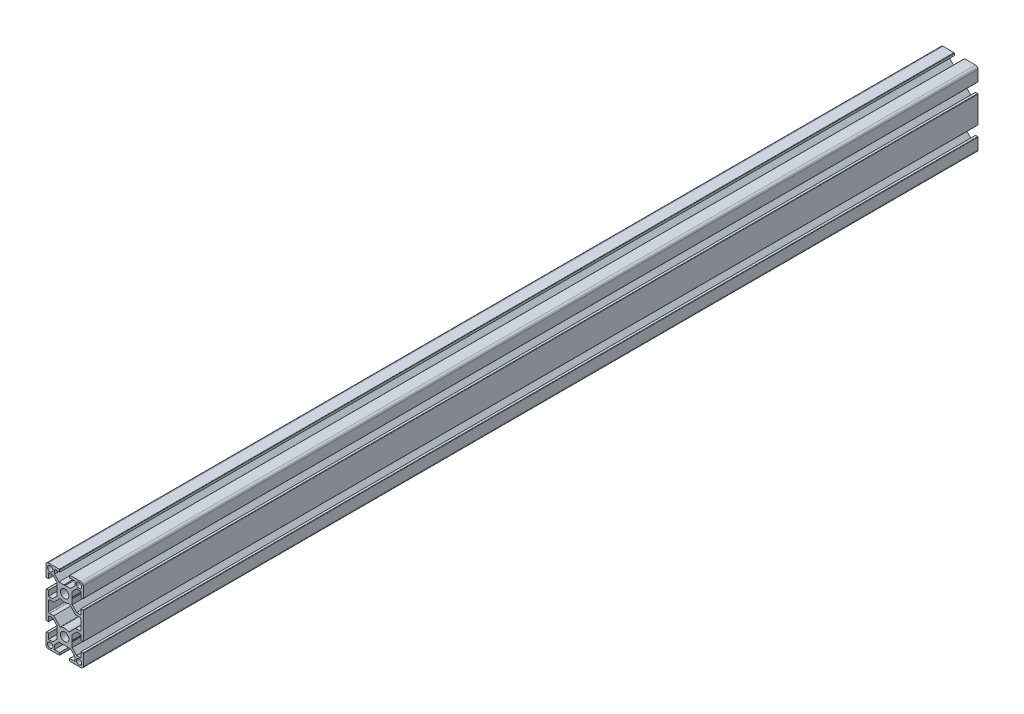
from build123d import *

# Parameters (mm, degrees)
SKETCH2_R           = 2.1
SKETCH2_R_2         = 3.4
BOSS_EXTRUDE1_DEPTH = 720


with BuildPart() as part:
    # Sketch2 → Boss-Extrude1 (new body)
    with BuildSketch(Plane.XY):
        with BuildLine():
            Line((-13, -30), (-4.3, -30))
            ThreePointArc((-4.3, -30), (-4.087867966, -29.912132034), (-4, -29.7))
            Line((-4, -29.7), (-4, -28))
            Line((-4, -28), (-8.249999995, -28))
            Line((-8.249999995, -28), (-8.249999995, -24.664213567))
            Line((-8.249999995, -24.664213567), (-4.585786428, -21))
            Line((-4.585786428, -21), (-0.519615237, -21))
            Line((-0.519615237, -21), (5e-09, -20.7))
            Line((5e-09, -20.7), (0.519615247, -21))
            Line((0.519615247, -21), (4.585786438, -21))
            Line((4.585786438, -21), (8.250000005, -24.664213567))
            Line((8.250000005, -24.664213567), (8.250000005, -28))
            Line((8.250000005, -28), (4, -28))
            Line((4, -28), (4, -29.7))
            ThreePointArc((4, -29.7), (4.087867966, -29.912132034), (4.3, -30))
            Line((4.3, -30), (13, -30))
            ThreePointArc((13, -30), (14.414213562, -29.414213562), (15, -28))
            Line((15, -28), (15, -19.3000023))
            ThreePointArc((15, -19.3000023), (14.912132034, -19.087870266), (14.7, -19.0000023))
            Line((14.7, -19.0000023), (13.000000005, -19.0000023))
            Line((13.000000005, -19.0000023), (13.000000005, -23.250000005))
            Line((13.000000005, -23.250000005), (9.664213567, -23.250000005))
            Line((9.664213567, -23.250000005), (6.000000005, -19.585786443))
            Line((6.000000005, -19.585786443), (6.000000005, -15.519615247))
            Line((6.000000005, -15.519615247), (5.700000005, -15.000000005))
            Line((5.700000005, -15.000000005), (6.000000005, -14.480384763))
            Line((6.000000005, -14.480384763), (6.000000005, -10.414213567))
            Line((6.000000005, -10.414213567), (9.664213567, -6.750000005))
            Line((9.664213567, -6.750000005), (13.000000005, -6.750000005))
            Line((13.000000005, -6.750000005), (13.000000005, -11.0000023))
            Line((13.000000005, -11.0000023), (14.7, -11.0000023))
            ThreePointArc((14.7, -11.0000023), (14.912132034, -10.912134335), (15, -10.7000023))
            Line((15, -10.7000023), (15, 10.7000023))
            ThreePointArc((15, 10.7000023), (14.912132034, 10.912134335), (14.7, 11.0000023))
            Line((14.7, 11.0000023), (13.000000005, 11.0000023))
            Line((13.000000005, 11.0000023), (13.000000005, 6.749999995))
            Line((13.000000005, 6.749999995), (9.664213567, 6.749999995))
            Line((9.664213567, 6.749999995), (6.000000005, 10.414213557))
            Line((6.000000005, 10.414213557), (6.000000005, 14.480384753))
            Line((6.000000005, 14.480384753), (5.700000005, 14.999999995))
            Line((5.700000005, 14.999999995), (6.000000005, 15.519615237))
            Line((6.000000005, 15.519615237), (6.000000005, 19.585786433))
            Line((6.000000005, 19.585786433), (9.664213567, 23.249999995))
            Line((9.664213567, 23.249999995), (13.000000005, 23.249999995))
            Line((13.000000005, 23.249999995), (13.000000005, 19.0000023))
            Line((13.000000005, 19.0000023), (14.7, 19.0000023))
            ThreePointArc((14.7, 19.0000023), (14.912132034, 19.087870266), (15, 19.3000023))
            Line((15, 19.3000023), (15, 28))
            ThreePointArc((15, 28), (14.414213562, 29.414213562), (13, 30))
            Line((13, 30), (4.3, 30))
            ThreePointArc((4.3, 30), (4.087867966, 29.912132034), (4, 29.7))
            Line((4, 29.7), (4, 28))
            Line((4, 28), (8.250000005, 28))
            Line((8.250000005, 28), (8.250000005, 24.664213557))
            Line((8.250000005, 24.664213557), (4.585786448, 21))
            Line((4.585786448, 21), (0.519615247, 21))
            Line((0.519615247, 21), (5e-09, 20.7))
            Line((5e-09, 20.7), (-0.519615237, 21))
            Line((-0.519615237, 21), (-4.585786438, 21))
            Line((-4.585786438, 21), (-8.249999995, 24.664213557))
            Line((-8.249999995, 24.664213557), (-8.249999995, 28))
            Line((-8.249999995, 28), (-4, 28))
            Line((-4, 28), (-4, 29.7))
            ThreePointArc((-4, 29.7), (-4.087867966, 29.912132034), (-4.3, 30))
            Line((-4.3, 30), (-13, 30))
            ThreePointArc((-13, 30), (-14.414213562, 29.414213562), (-15, 28))
            Line((-15, 28), (-15, 19.3000023))
            ThreePointArc((-15, 19.3000023), (-14.912132034, 19.087870266), (-14.7, 19.0000023))
            Line((-14.7, 19.0000023), (-12.999999995, 19.0000023))
            Line((-12.999999995, 19.0000023), (-12.999999995, 23.249999995))
            Line((-12.999999995, 23.249999995), (-9.664213557, 23.249999995))
            Line((-9.664213557, 23.249999995), (-5.999999995, 19.585786433))
            Line((-5.999999995, 19.585786433), (-5.999999995, 15.519615237))
            Line((-5.999999995, 15.519615237), (-5.699999995, 14.999999995))
            Line((-5.699999995, 14.999999995), (-5.999999995, 14.480384753))
            Line((-5.999999995, 14.480384753), (-5.999999995, 10.414213557))
            Line((-5.999999995, 10.414213557), (-9.664213557, 6.749999995))
            Line((-9.664213557, 6.749999995), (-12.999999995, 6.749999995))
            Line((-12.999999995, 6.749999995), (-12.999999995, 11.0000023))
            Line((-12.999999995, 11.0000023), (-14.7, 11.0000023))
            ThreePointArc((-14.7, 11.0000023), (-14.912132034, 10.912134335), (-15, 10.7000023))
            Line((-15, 10.7000023), (-15, -10.7000023))
            ThreePointArc((-15, -10.7000023), (-14.912132034, -10.912134335), (-14.7, -11.0000023))
            Line((-14.7, -11.0000023), (-12.999999995, -11.0000023))
            Line((-12.999999995, -11.0000023), (-12.999999995, -6.750000005))
            Line((-12.999999995, -6.750000005), (-9.664213557, -6.750000005))
            Line((-9.664213557, -6.750000005), (-5.999999995, -10.414213567))
            Line((-5.999999995, -10.414213567), (-5.999999995, -14.480384763))
            Line((-5.999999995, -14.480384763), (-5.699999995, -15.000000005))
            Line((-5.699999995, -15.000000005), (-5.999999995, -15.519615247))
            Line((-5.999999995, -15.519615247), (-5.999999995, -19.585786443))
            Line((-5.999999995, -19.585786443), (-9.664213557, -23.250000005))
            Line((-9.664213557, -23.250000005), (-12.999999995, -23.250000005))
            Line((-12.999999995, -23.250000005), (-12.999999995, -19.0000023))
            Line((-12.999999995, -19.0000023), (-14.7, -19.0000023))
            ThreePointArc((-14.7, -19.0000023), (-14.912132034, -19.087870266), (-15, -19.3000023))
            Line((-15, -19.3000023), (-15, -28))
            ThreePointArc((-15, -28), (-14.414213562, -29.414213562), (-13, -30))
        make_face()
        with Locations(Location((11.625000005, 26.624999995, 0), (0, 0, 180))):
            Circle(SKETCH2_R, mode=Mode.SUBTRACT)
        with Locations(Location((11.625000005, -26.625000005, 0), (0, 0, 180))):
            Circle(SKETCH2_R, mode=Mode.SUBTRACT)
        with Locations(Location((4.55e-07, -15.00000049, 0), (0, 0, 180))):
            Circle(SKETCH2_R_2, mode=Mode.SUBTRACT)
        with Locations(Location((4.55e-07, 15.0000023, 0), (0, 0, 180))):
            Circle(SKETCH2_R_2, mode=Mode.SUBTRACT)
        with Locations(Location((-11.624999995, 26.624999995, 0), (0, 0, 180))):
            Circle(SKETCH2_R, mode=Mode.SUBTRACT)
        with Locations(Location((-11.624999995, -26.625000005, 0), (0, 0, 180))):
            Circle(SKETCH2_R, mode=Mode.SUBTRACT)
        with BuildLine():
            Line((-12.999999995, 3.749999995), (-12.999999995, -3.750000005))
            ThreePointArc((-12.999999995, -3.750000005), (-12.707106776, -4.457106786), (-11.999999995, -4.750000005))
            Line((-11.999999995, -4.750000005), (-8.835786433, -4.750000005))
            Line((-8.835786433, -4.750000005), (-3.651790591, -9.933995846))
            ThreePointArc((-3.651790591, -9.933995846), (-3.470778838, -10.020245326), (-3.275865231, -9.973203714))
            ThreePointArc((-3.275865231, -9.973203714), (1.45e-07, -9.000002005), (3.275865622, -9.973203376))
            ThreePointArc((3.275865622, -9.973203376), (3.470779219, -10.02024497), (3.651790956, -9.933995491))
            Line((3.651790956, -9.933995491), (8.835786443, -4.750000005))
            Line((8.835786443, -4.750000005), (12.000000005, -4.750000005))
            ThreePointArc((12.000000005, -4.750000005), (12.707106786, -4.457106786), (13.000000005, -3.750000005))
            Line((13.000000005, -3.750000005), (13.000000005, 3.749999995))
            ThreePointArc((13.000000005, 3.749999995), (12.707106786, 4.457106776), (12.000000005, 4.749999995))
            Line((12.000000005, 4.749999995), (8.835786443, 4.749999995))
            Line((8.835786443, 4.749999995), (3.6517913, 9.933995138))
            ThreePointArc((3.6517913, 9.933995138), (3.470779584, 10.020244614), (3.275866001, 9.973203046))
            ThreePointArc((3.275866001, 9.973203046), (1.45e-07, 9.000001815), (-3.27586561, 9.973203384))
            ThreePointArc((-3.27586561, 9.973203384), (-3.470779203, 10.020244971), (-3.651790935, 9.933995493))
            Line((-3.651790935, 9.933995493), (-8.835786433, 4.749999995))
            Line((-8.835786433, 4.749999995), (-11.999999995, 4.749999995))
            ThreePointArc((-11.999999995, 4.749999995), (-12.707106776, 4.457106776), (-12.999999995, 3.749999995))
        make_face(mode=Mode.SUBTRACT)
    extrude(amount=BOSS_EXTRUDE1_DEPTH)


solid = part.part
